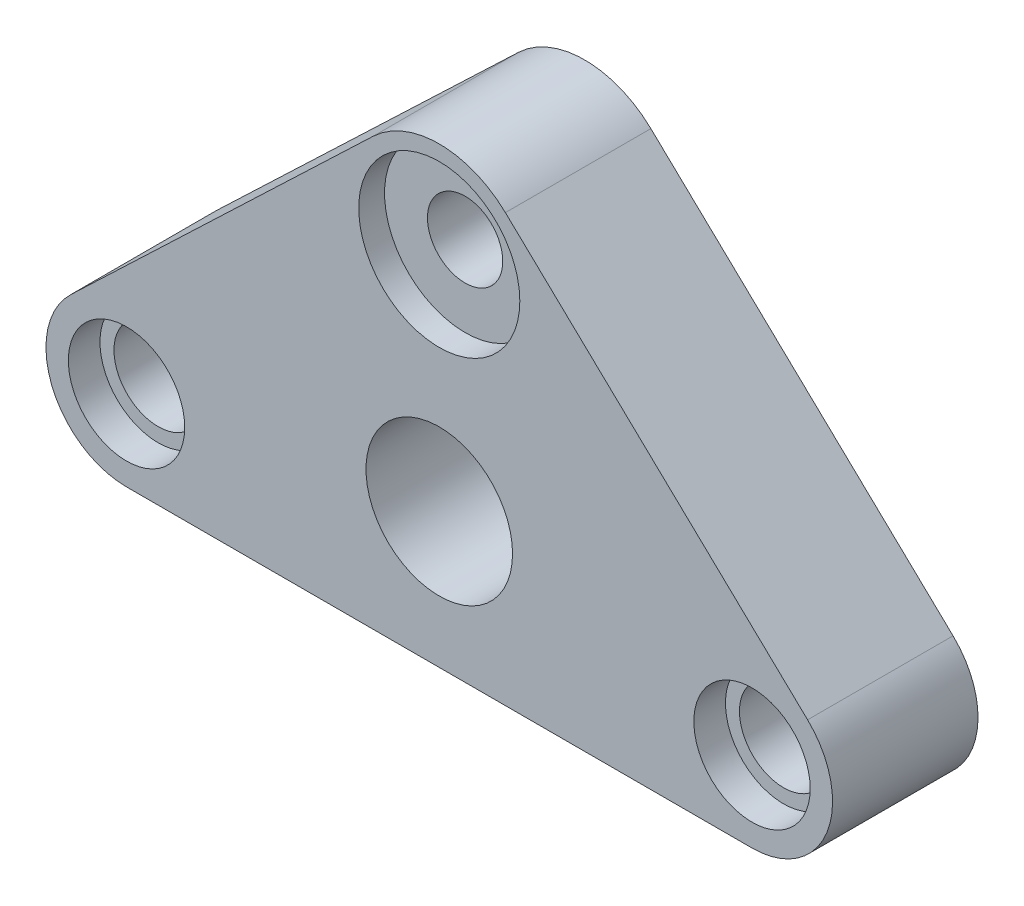
from build123d import *

# Parameters (mm, degrees)
SKETCH1_R           = 5.175
SKETCH1_R_2         = 6.075
BOSS_EXTRUDE1_DEPTH = 20
SKETCH2_R           = 11.075
CUT_EXTRUDE1_DEPTH  = 3.55
SKETCH3_R           = 8
CUT_EXTRUDE2_DEPTH  = 4.35
CUT_EXTRUDE3_START  = -4.35
SKETCH4_R           = 8
CUT_EXTRUDE3_DEPTH  = 4.35
SKETCH5_R           = 10.075
CUT_EXTRUDE4_DEPTH  = 15
SKETCH6_R           = 1.75
CUT_EXTRUDE5_DEPTH  = 5


with BuildPart() as part:
    # Sketch1 → Boss-Extrude1 (new body)
    with BuildSketch(Plane.XY):
        with BuildLine():
            Line((9.091765785, 9.535219972), (50.642603876, -30.08321455))
            ThreePointArc((50.642603876, -30.08321455), (53.281680295, -42.214737327), (43, -49.173589213))
            Line((43, -49.173589213), (-43, -49.173589213))
            ThreePointArc((-43, -49.173589213), (-53.281680295, -42.214737327), (-50.642603876, -30.08321455))
            Line((-50.642603876, -30.08321455), (-9.091765785, 9.535219972))
            ThreePointArc((-9.091765785, 9.535219972), (0, 13.175), (9.091765785, 9.535219972))
        make_face()
        Circle(SKETCH1_R, mode=Mode.SUBTRACT)
        with Locations((43, -38.098589213)):
            Circle(SKETCH1_R_2, mode=Mode.SUBTRACT)
        with Locations((-43, -38.098589213)):
            Circle(SKETCH1_R_2, mode=Mode.SUBTRACT)
    extrude(amount=BOSS_EXTRUDE1_DEPTH)

    # Sketch2 → Cut-Extrude1 (cut)
    with BuildSketch(Plane.XY.offset(20)):
        Circle(SKETCH2_R)
    extrude(amount=-CUT_EXTRUDE1_DEPTH, mode=Mode.SUBTRACT)

    # Sketch3 → Cut-Extrude2 (cut)
    with BuildSketch(Plane(origin=(0, 0, 0), x_dir=(-1, 0, 0), z_dir=(0, 0, -1))):
        with Locations((43, -38.098589213)):
            Circle(SKETCH3_R)
        with Locations((-43, -38.098589213)):
            Circle(SKETCH3_R)
    extrude(amount=-CUT_EXTRUDE2_DEPTH, mode=Mode.SUBTRACT)

    # Sketch4 → Cut-Extrude3 (cut)
    with BuildSketch(Plane.XY.offset(20).offset(CUT_EXTRUDE3_START)):
        with Locations(Location((-43, -38.098589213, 0), (0, 0, 180))):
            Circle(SKETCH4_R)
        with Locations(Location((43, -38.098589213, 0), (0, 0, 180))):
            Circle(SKETCH4_R)
    extrude(amount=CUT_EXTRUDE3_DEPTH, mode=Mode.SUBTRACT)

    # Sketch5 → Cut-Extrude4 (cut)
    with BuildSketch(Plane.XY.offset(20)):
        with Locations((0, -30.593589213)):
            Circle(SKETCH5_R)
    extrude(amount=-CUT_EXTRUDE4_DEPTH, mode=Mode.SUBTRACT)

    # Sketch6 → Cut-Extrude5 (cut)
    with BuildSketch(Plane.XY.offset(5)):
        with Locations((0, -30.593589213)):
            Circle(SKETCH6_R)
    extrude(amount=-CUT_EXTRUDE5_DEPTH, mode=Mode.SUBTRACT)


solid = part.part
